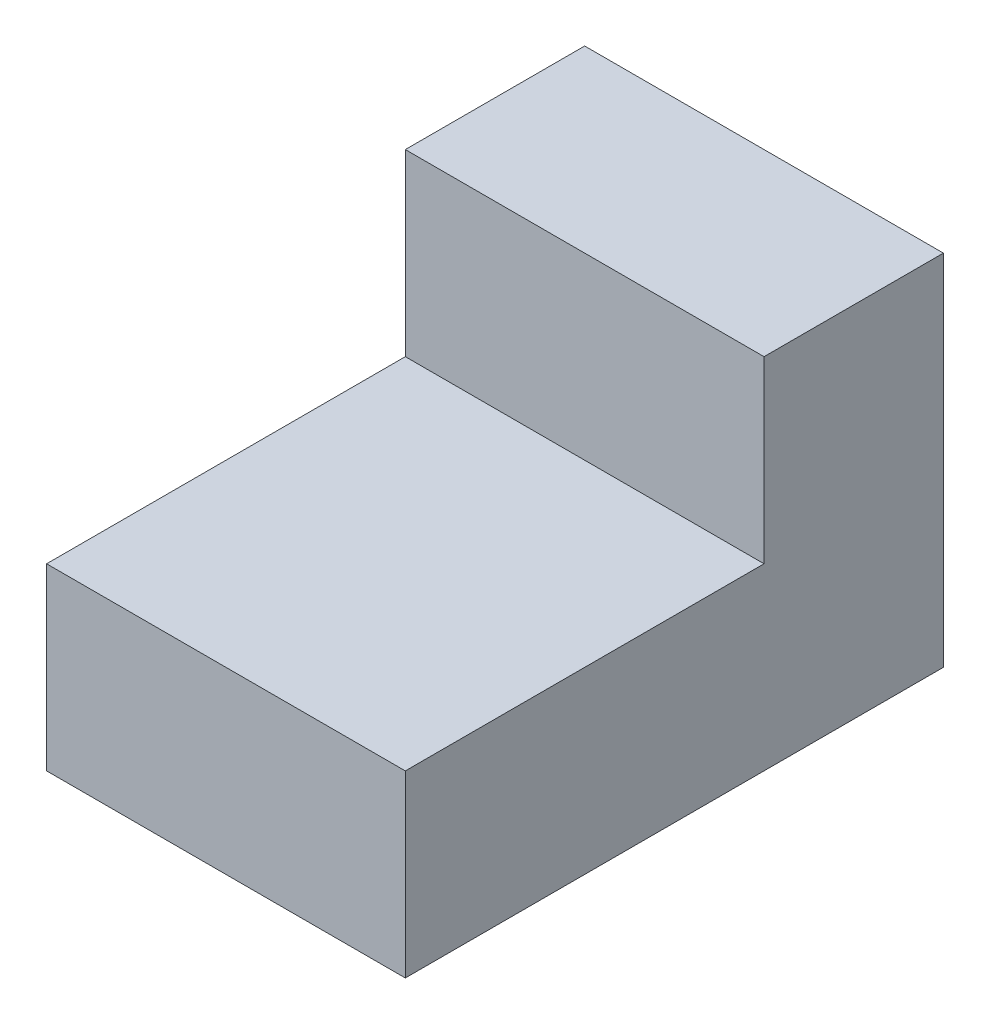
from build123d import *

# Parameters (mm, degrees)
SKETCH1_W           = 25.4
SKETCH1_H           = 38.1
BOSS_EXTRUDE1_DEPTH = 12.7
SKETCH2_W           = 25.4
SKETCH2_H           = 12.7
BOSS_EXTRUDE2_DEPTH = 12.7


with BuildPart() as part:
    # Sketch1 → Boss-Extrude1 (new body)
    with BuildSketch(Plane(origin=(0, 0, 0), x_dir=(1, 0, 0), z_dir=(0, 1, 0))):
        Rectangle(SKETCH1_W, SKETCH1_H)
    extrude(amount=BOSS_EXTRUDE1_DEPTH)

    # Sketch2 → Boss-Extrude2 (add)
    with BuildSketch(Plane(origin=(0, 12.7, 0), x_dir=(1, 0, 0), z_dir=(0, 1, 0))):
        with Locations((0, 12.7)):
            Rectangle(SKETCH2_W, SKETCH2_H)
    extrude(amount=BOSS_EXTRUDE2_DEPTH)


solid = part.part
